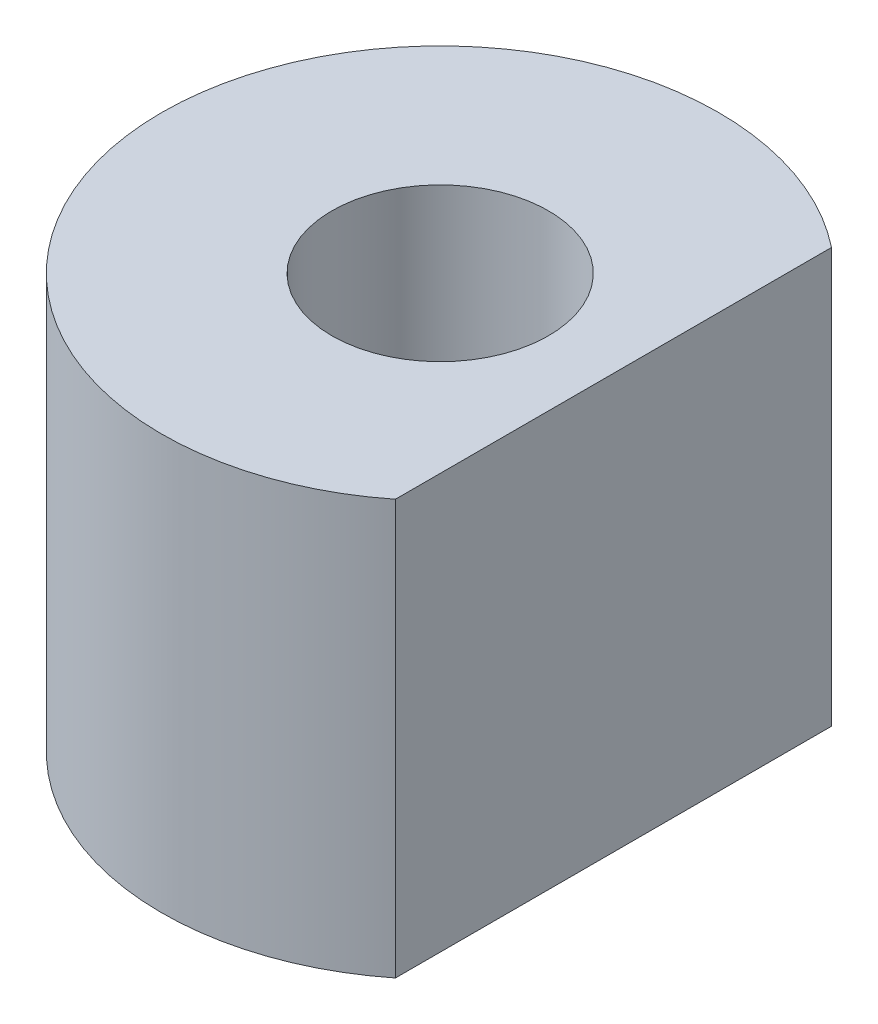
from build123d import *

# Parameters (mm, degrees)
SKETCH_2_R      = 1.75
EXTRUDE_1_DEPTH = 6.7


with BuildPart() as part:
    # 草图2 → 凸台-拉伸1 (new body)
    with BuildSketch(Plane(origin=(0, 0, 0), x_dir=(1, 0, 0), z_dir=(0, 1, 0))):
        with BuildLine():
            Line((2.8, -3.522782991), (2.8, 3.522782991))
            ThreePointArc((2.8, 3.522782991), (-4.5, 0), (2.8, -3.522782991))
        make_face()
        with Locations(Location((0, 0, 0), (0, 0, 270))):
            Circle(SKETCH_2_R, mode=Mode.SUBTRACT)
    extrude(amount=EXTRUDE_1_DEPTH)


solid = part.part
